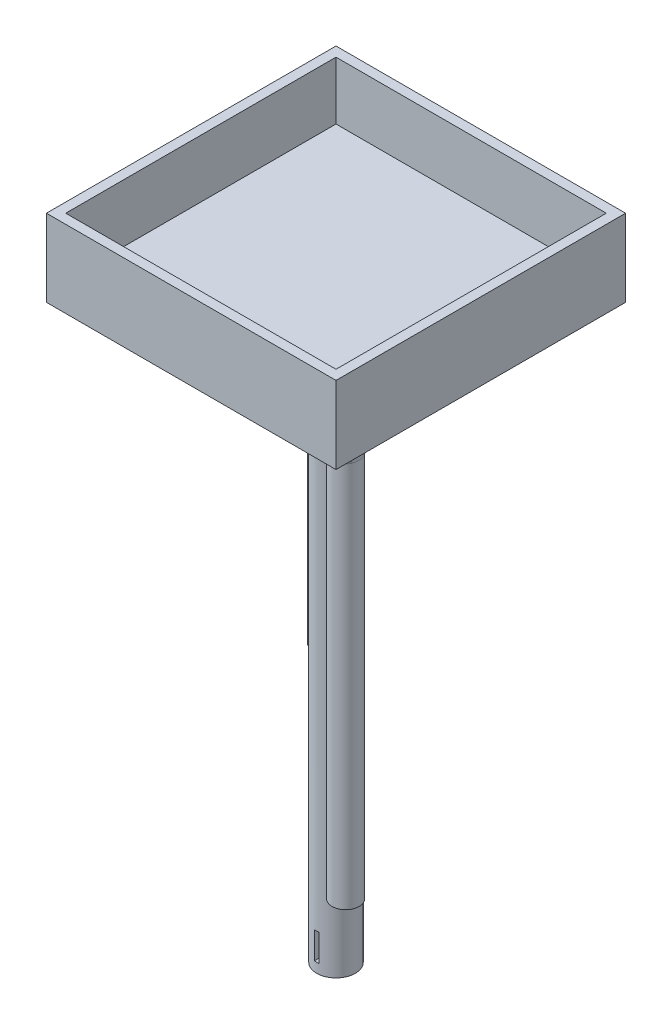
from build123d import *

# Parameters (mm, degrees)
ESBO_O1_W                = 75
ESBO_O1_H                = 75
RESSALTO_EXTRUS_O1_DEPTH = 20
ESBO_O2_W                = 70
ESBO_O2_H                = 70
CORTE_EXTRUS_O1_DEPTH    = 15
ESBO_O3_R                = 5
RESSALTO_EXTRUS_O2_DEPTH = 148
ESBO_O5_W                = 1.2
ESBO_O5_H                = 7
CORTE_EXTRUS_O2_DEPTH    = 70
ESBO_O7_R                = 3.5
RESSALTO_EXTRUS_O3_DEPTH = 105
FILETE2_R                = 5
FILETE3_R                = 5
FILETE4_R                = 5


with BuildPart() as part:
    # Esboço1 → Ressalto-extrusão1 (new body)
    with BuildSketch(Plane(origin=(0, 0, 0), x_dir=(1, 0, 0), z_dir=(0, 1, 0))):
        Rectangle(ESBO_O1_W, ESBO_O1_H)
    extrude(amount=RESSALTO_EXTRUS_O1_DEPTH)

    # Esboço2 → Corte-extrusão1 (cut)
    with BuildSketch(Plane(origin=(0, 20, 0), x_dir=(1, 0, 0), z_dir=(0, 1, 0))):
        Rectangle(ESBO_O2_W, ESBO_O2_H)
    extrude(amount=-CORTE_EXTRUS_O1_DEPTH, mode=Mode.SUBTRACT)

    # Esboço3 → Ressalto-extrusão2 (add)
    with BuildSketch(Plane(origin=(0, 0, 0), x_dir=(-1, 0, 0), z_dir=(0, -1, 0))):
        with Locations(Location((0, 0, 0), (0, 0, 90))):
            Circle(ESBO_O3_R)
    extrude(amount=RESSALTO_EXTRUS_O2_DEPTH)

    # Esboço5 → Corte-extrusão2 (cut)
    with BuildSketch(Plane(origin=(0, 0, -37.5), x_dir=(-1, 0, 0), z_dir=(0, 0, -1))):
        with Locations((0, -142)):
            Rectangle(ESBO_O5_W, ESBO_O5_H)
    extrude(amount=-CORTE_EXTRUS_O2_DEPTH, mode=Mode.SUBTRACT)

    # Esboço7 → Ressalto-extrusão3 (add)
    with BuildSketch(Plane.XZ):
        with Locations(Location((30, 27.5, 0), (0, 0, 270))):
            Circle(ESBO_O7_R)
        with Locations(Location((-30, -27.5, 0), (0, 0, 270))):
            Circle(ESBO_O7_R)
    extrude(amount=RESSALTO_EXTRUS_O3_DEPTH)

    # Filete2
    filete2_edges = [part.edges().sort_by_distance(p)[0] for p in [
        (-30, 0, -24),
    ]]
    fillet(filete2_edges, radius=FILETE2_R)

    # Filete3
    filete3_edges = [part.edges().sort_by_distance(p)[0] for p in [
        (30, 0, 31),
    ]]
    fillet(filete3_edges, radius=FILETE3_R)

    # Filete4
    filete4_edges = [part.edges().sort_by_distance(p)[0] for p in [
        (0, 0, 5),
    ]]
    fillet(filete4_edges, radius=FILETE4_R)


solid = part.part
